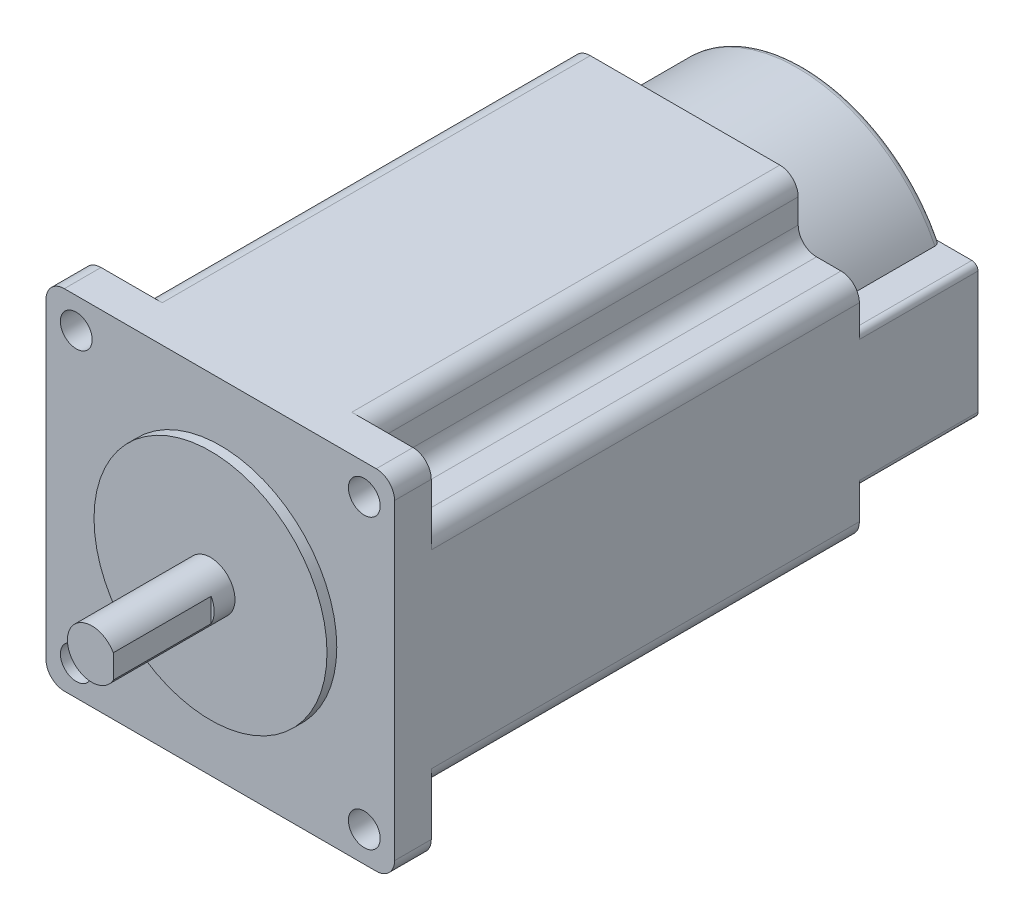
from build123d import *

# Parameters (mm, degrees)
SKETCH_1_W          = 57
SKETCH_1_H          = 57
EXTRUDE_1_DEPTH     = 76
SKETCH_2_W          = 10
SKETCH_2_H          = 10
CUT_EXTRUDE_1_DEPTH = 70
SKETCH_3_R          = 2.6
CUT_EXTRUDE_2_DEPTH = 90.979320355
FILLET_2_R          = 3
SKETCH_4_R          = 19.05
EXTRUDE_2_DEPTH     = 1.6
SKETCH_5_R          = 4
EXTRUDE_3_DEPTH     = 19.4
CUT_EXTRUDE_START   = -16
CUT_EXTRUDE_3_DEPTH = 16
EXTRUDE_4_DEPTH     = 19.4
FILLET_3_R          = 1
FILLET_4_R          = 1
FILLET_5_R          = 1


with BuildPart() as part:
    # 草图1 → 凸台-拉伸1 (new body)
    with BuildSketch(Plane.XY):
        with Locations((-10.110253485, -0.301500263)):
            Rectangle(SKETCH_1_W, SKETCH_1_H)
    extrude(amount=EXTRUDE_1_DEPTH)

    # 草图2 → 切除-拉伸1 (cut)
    with BuildSketch(Plane(origin=(0, 0, 0), x_dir=(-1, 0, 0), z_dir=(0, 0, -1))):
        with Locations((-13.389746515, 23.198499737)):
            Rectangle(SKETCH_2_W, SKETCH_2_H)
        with Locations((33.610253485, 23.198499737)):
            Rectangle(SKETCH_2_W, SKETCH_2_H)
        with Locations((33.610253485, -23.801500263)):
            Rectangle(SKETCH_2_W, SKETCH_2_H)
        with Locations((-13.389746515, -23.801500263)):
            Rectangle(SKETCH_2_W, SKETCH_2_H)
    extrude(amount=-CUT_EXTRUDE_1_DEPTH, mode=Mode.SUBTRACT)

    # 草图3 → 切除-拉伸2 (cut, through all)
    with BuildSketch(Plane.XY.offset(76)):
        with Locations((13.439746515, 23.248499737)):
            Circle(SKETCH_3_R)
        with Locations((-33.660253485, 23.248499737)):
            Circle(SKETCH_3_R)
        with Locations((-33.660253485, -23.851500263)):
            Circle(SKETCH_3_R)
        with Locations((13.439746515, -23.851500263)):
            Circle(SKETCH_3_R)
    extrude(amount=-CUT_EXTRUDE_2_DEPTH, mode=Mode.SUBTRACT)

    # 圆角2
    fillet_2_edges = [part.edges().sort_by_distance(p)[0] for p in [
        (18.389746515, 18.198499737, 35),
        (8.389746515, 28.198499737, 35),
        (8.389746515, 18.198499737, 35),
        (-38.610253485, 18.198499737, 35),
        (-28.610253485, 18.198499737, 35),
        (-28.610253485, 28.198499737, 35),
        (-38.610253485, -18.801500263, 35),
        (-28.610253485, -28.801500263, 35),
        (-28.610253485, -18.801500263, 35),
        (18.389746515, -18.801500263, 35),
        (8.389746515, -18.801500263, 35),
        (8.389746515, -28.801500263, 35),
        (-38.610253485, 28.198499737, 73),
        (18.389746515, 28.198499737, 73),
        (18.389746515, -28.801500263, 73),
        (-38.610253485, -28.801500263, 73),
    ]]
    fillet(fillet_2_edges, radius=FILLET_2_R)

    # 草图4 → 凸台-拉伸2 (add)
    with BuildSketch(Plane.XY.offset(76)):
        with Locations((-10.110253485, -0.301500263)):
            Circle(SKETCH_4_R)
    extrude(amount=EXTRUDE_2_DEPTH)

    # 草图5 → 凸台-拉伸3 (add)
    with BuildSketch(Plane.XY.offset(77.6)):
        with Locations((-10.110253485, -0.301500263)):
            Circle(SKETCH_5_R)
    extrude(amount=EXTRUDE_3_DEPTH)

    # 草图6 → 切除-拉伸3 (cut)
    with BuildSketch(Plane.XY.offset(97).offset(CUT_EXTRUDE_START)):
        with BuildLine():
            Line((-6.610253485, 1.63499141), (-6.610253485, -2.237991937))
            ThreePointArc((-6.610253485, -2.237991937), (-6.110253485, -0.301500263), (-6.610253485, 1.63499141))
        make_face()
    extrude(amount=CUT_EXTRUDE_3_DEPTH, mode=Mode.SUBTRACT)

    # 草图7 → 凸台-拉伸4 (add)
    with BuildSketch(Plane(origin=(0, 0, 0), x_dir=(-1, 0, 0), z_dir=(0, 0, -1))):
        with BuildLine():
            Line((-12.349002987, -10.964529416), (-18.389746515, -10.964529416))
            Line((-18.389746515, -10.964529416), (-18.389746515, 10.997444042))
            Line((-18.389746515, 10.997444042), (-12.349002987, 10.997444042))
            ThreePointArc((-12.349002987, 10.997444042), (35.110247456, 0.016457313), (-12.349002987, -10.964529416))
        make_face()
    extrude(amount=EXTRUDE_4_DEPTH)

    # 圆角3
    fillet_3_edges = [part.edges().sort_by_distance(p)[0] for p in [
        (18.389746515, 10.997444042, -9.7),
    ]]
    fillet(fillet_3_edges, radius=FILLET_3_R)

    # 圆角4
    fillet_4_edges = [part.edges().sort_by_distance(p)[0] for p in [
        (18.389746515, -10.964529416, -9.7),
    ]]
    fillet(fillet_4_edges, radius=FILLET_4_R)

    # 圆角5
    fillet_5_edges = [part.edges().sort_by_distance(p)[0] for p in [
        (-35.110247456, 0.016457313, -19.4),
    ]]
    fillet(fillet_5_edges, radius=FILLET_5_R)


solid = part.part
